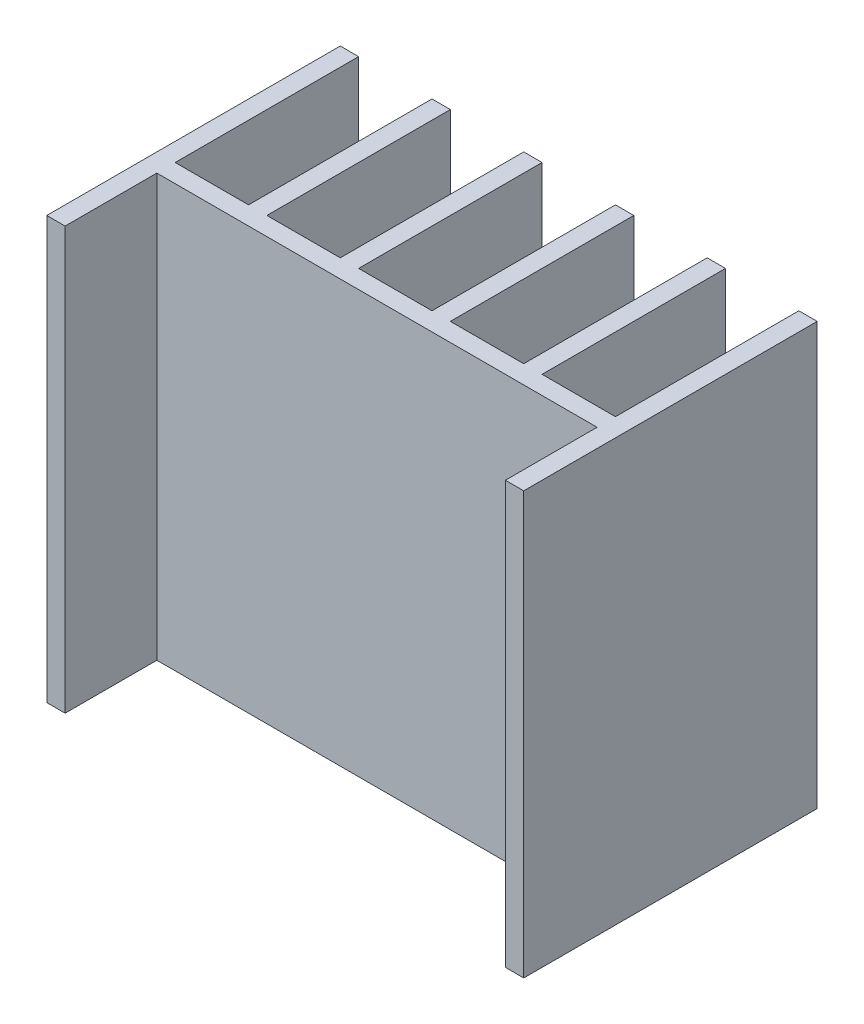
from build123d import *

# Parameters (mm, degrees)
BOSS_EXTRU_1_DEPTH = 23


with BuildPart() as part:
    # Esquisse1 → Boss.-Extru.1 (new body)
    with BuildSketch(Plane(origin=(0, 0, 0), x_dir=(1, 0, 0), z_dir=(0, 1, 0))):
        Polygon((7, 11), (8, 11), (8, 1), (12, 1), (12, 11), (13, 11), (13, -3.968463396), (13, -5), (12, -5), (12, 0), (-12, 0), (-12, -5), (-13, -5), (-13, -3.968463396), (-13, 11), (-12, 11), (-12, 1), (-8, 1), (-8, 11), (-7, 11), (-7, 1), (-3, 1), (-3, 11), (-2, 11), (-2, 1), (2, 1), (2, 11), (3, 11), (3, 1), (7, 1), align=None)
    extrude(amount=BOSS_EXTRU_1_DEPTH)


solid = part.part
